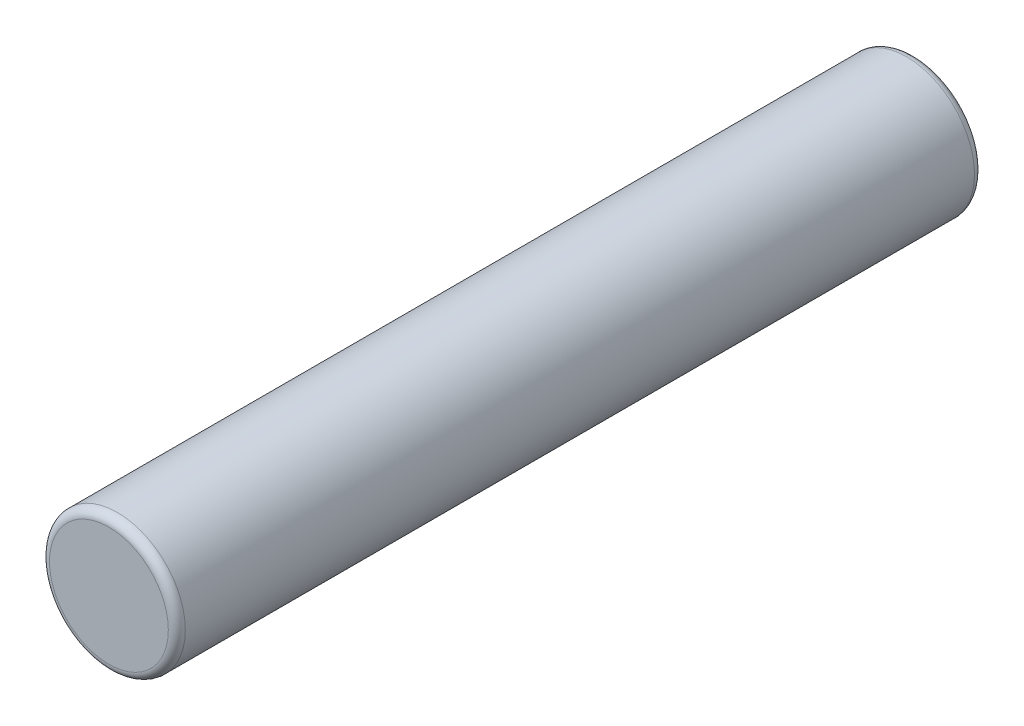
from build123d import *

# Parameters (mm, degrees)
SKETCH1_R           = 20.32
BOSS_EXTRUDE1_DEPTH = 241.3
FILLET1_R           = 2.54


with BuildPart() as part:
    # Sketch1 → Boss-Extrude1 (new body)
    with BuildSketch(Plane.XY):
        with Locations(Location((0, 0, 0), (0, 0, 180))):
            Circle(SKETCH1_R)
    extrude(amount=BOSS_EXTRUDE1_DEPTH)

    # Fillet1
    fillet1_edges = [part.edges().sort_by_distance(p)[0] for p in [
        (20.32, 0, 0),
        (20.32, 0, 241.3),
    ]]
    fillet(fillet1_edges, radius=FILLET1_R)


solid = part.part
